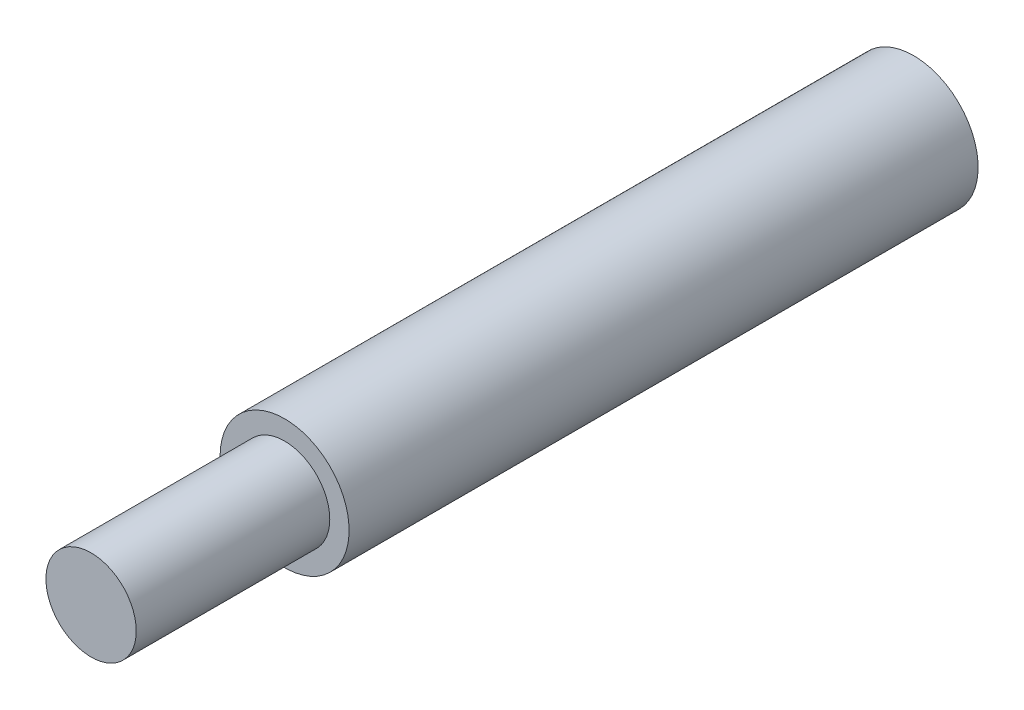
from build123d import *

# Parameters (mm, degrees)
SKETCH1_R           = 1.4
BOSS_EXTRUDE1_DEPTH = 6
SKETCH2_R           = 2
BOSS_EXTRUDE2_DEPTH = 19.5
SKETCH3_R           = 1.4
CUT_EXTRUDE1_DEPTH  = 10


with BuildPart() as part:
    # Sketch1 → Boss-Extrude1 (new body)
    with BuildSketch(Plane.XY):
        Circle(SKETCH1_R)
    extrude(amount=BOSS_EXTRUDE1_DEPTH)

    # Sketch2 → Boss-Extrude2 (add)
    with BuildSketch(Plane(origin=(0, 0, 0), x_dir=(-1, 0, 0), z_dir=(0, 0, -1))):
        Circle(SKETCH2_R)
    extrude(amount=BOSS_EXTRUDE2_DEPTH)

    # Sketch3 → Cut-Extrude1 (cut)
    with BuildSketch(Plane(origin=(0, 0, -19.5), x_dir=(-1, 0, 0), z_dir=(0, 0, -1))):
        with Locations(Location((0, 0, 0), (0, 0, 180))):
            Circle(SKETCH3_R)
    extrude(amount=-CUT_EXTRUDE1_DEPTH, mode=Mode.SUBTRACT)


solid = part.part
